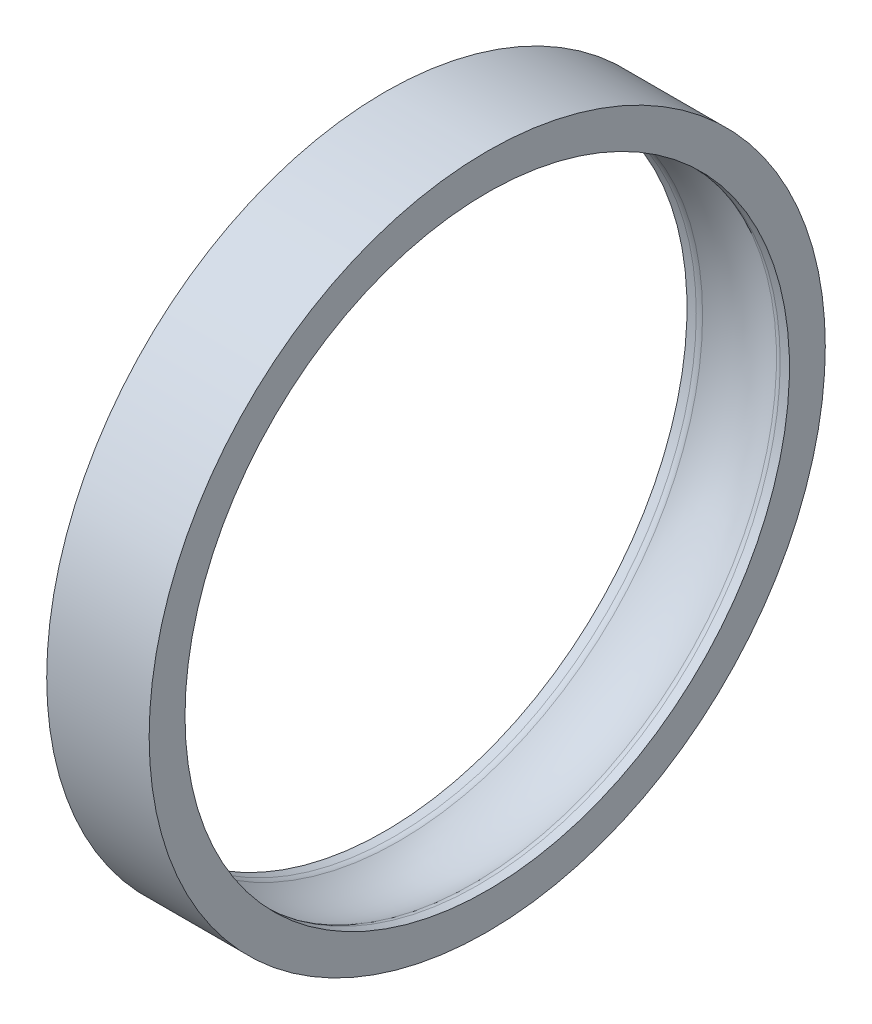
from build123d import *

# Parameters (mm, degrees)
FILLET1_R = 2


with BuildPart() as part:
    # Sketch1 → Revolve5 (revolve)
    with BuildSketch(Plane.XY, mode=Mode.PRIVATE) as revolve5_sk:
        with BuildLine():
            ThreePointArc((7.653112519, 59), (0, 61.144988127), (-7.653112519, 59))
            Line((-7.653112519, 59), (-10, 59))
            Line((-10, 59), (-10, 66))
            Line((-10, 66), (10, 66))
            Line((10, 66), (10, 59))
            Line((10, 59), (7.653112519, 59))
        make_face()
    revolve(revolve5_sk.sketch.rotate(Axis((-1000, 0, 0), (1, 0, 0)), 90), axis=Axis((-1000, 0, 0), (1, 0, 0)))

    # Fillet1
    fillet1_edges = [part.edges().sort_by_distance(p)[0] for p in [
        (-7.653112519, 0, -59),
        (7.653112519, 0, -59),
    ]]
    fillet(fillet1_edges, radius=FILLET1_R)


solid = part.part
